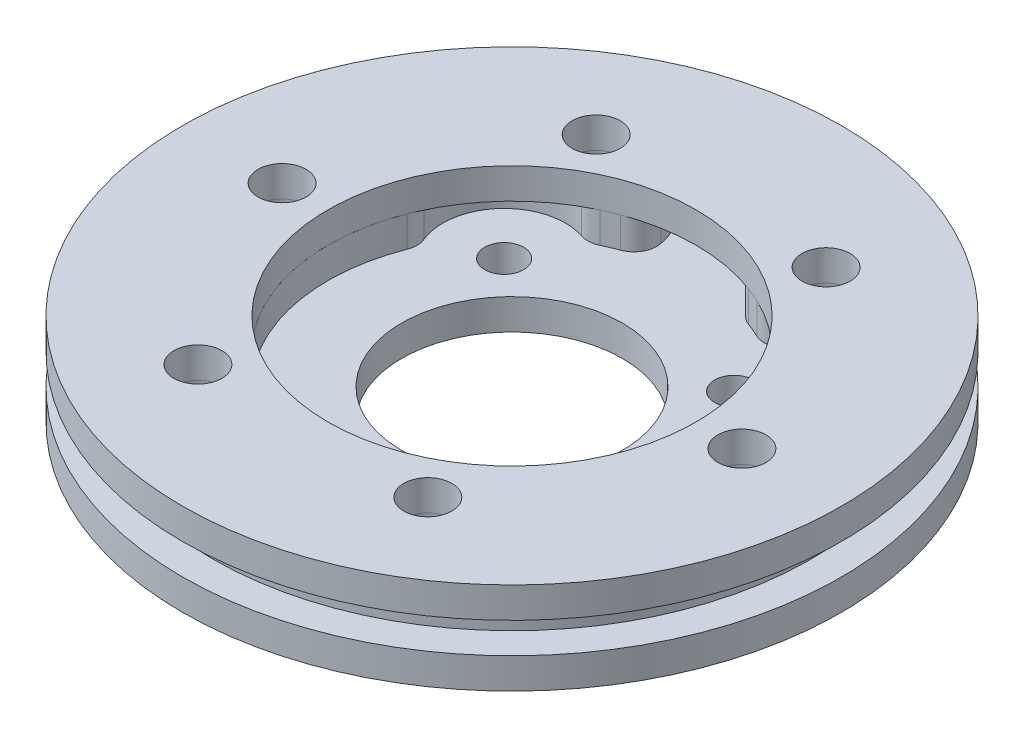
from build123d import *

# Parameters (mm, degrees)
SKETCH1_R           = 2.4892
BOSS_EXTRUDE1_DEPTH = 3.175
SKETCH2_R           = 34.13125
SKETCH2_R_2         = 2.4892
SKETCH2_R_3         = 11.43
SKETCH2_R_4         = 2.0193
BOSS_EXTRUDE2_DEPTH = 3.175
SKETCH3_R           = 6.35
CUT_EXTRUDE1_DEPTH  = 3.175
SKETCH4_R           = 34.13125
SKETCH4_R_2         = 19.05
SKETCH4_R_3         = 2.4892
BOSS_EXTRUDE3_DEPTH = 3.175
FILLET2_R           = 2.38125


with BuildPart() as part:
    # Sketch1 → Boss-Extrude1 (new body)
    with BuildSketch(Plane(origin=(0, 0, 0), x_dir=(1, 0, 0), z_dir=(0, 1, 0))):
        with BuildLine():
            ThreePointArc((-17.376939313, 25.618965517), (-14.497664233, -27.351547412), (30.95625, 0))
            ThreePointArc((30.95625, 0), (27.351547412, 14.497664233), (17.376939313, 25.618965517))
            ThreePointArc((17.376939313, 25.618965517), (8.910502717, 25.899620451), (5.012244188, 18.378789628))
            ThreePointArc((5.012244188, 18.378789628), (15.139117408, 11.563287772), (19.05, 0))
            ThreePointArc((19.05, 0), (-11.563287772, -15.139117408), (-5.012244188, 18.378789628))
            ThreePointArc((-5.012244188, 18.378789628), (-8.910502717, 25.899620451), (-17.376939313, 25.618965517))
        make_face()
        with Locations(Location((-11.90625, -20.622229928, 0), (0, 0, 270))):
            Circle(SKETCH1_R, mode=Mode.SUBTRACT)
        with Locations(Location((-23.8125, 0, 0), (0, 0, 270))):
            Circle(SKETCH1_R, mode=Mode.SUBTRACT)
        with Locations(Location((11.90625, -20.622229928, 0), (0, 0, 270))):
            Circle(SKETCH1_R, mode=Mode.SUBTRACT)
        with Locations(Location((-11.90625, 20.622229928, 0), (0, 0, 270))):
            Circle(SKETCH1_R, mode=Mode.SUBTRACT)
        with Locations(Location((23.8125, 0, 0), (0, 0, 270))):
            Circle(SKETCH1_R, mode=Mode.SUBTRACT)
        with Locations(Location((11.90625, 20.622229928, 0), (0, 0, 270))):
            Circle(SKETCH1_R, mode=Mode.SUBTRACT)
    extrude(amount=-BOSS_EXTRUDE1_DEPTH)

    # Sketch3 → Cut-Extrude1 (cut)
    with BuildSketch(Plane(origin=(0, 0, 0), x_dir=(1, 0, 0), z_dir=(0, 1, 0))):
        with Locations((-11.90625, 11.097229928)):
            Circle(SKETCH3_R)
        with Locations((11.90625, 11.097229928)):
            Circle(SKETCH3_R)
    extrude(amount=-CUT_EXTRUDE1_DEPTH, mode=Mode.SUBTRACT)

    # Fillet2
    fillet2_edges = [part.edges().sort_by_distance(p)[0] for p in [
        (-5.012244188, -1.5875, -18.378789628),
        (5.012244188, -1.5875, -18.378789628),
        (-17.359901154, -1.5875, -7.844509668),
        (-9.044696414, -1.5875, -16.765916819),
        (9.044696414, -1.5875, -16.765916819),
        (17.359901154, -1.5875, -7.844509668),
    ]]
    fillet(fillet2_edges, radius=FILLET2_R)


with BuildPart() as body_2:
    # Sketch2 → Boss-Extrude2 (new body)
    with BuildSketch(Plane(origin=(0, -3.175, 0), x_dir=(-1, 0, 0), z_dir=(0, -1, 0))):
        with Locations(Location((0, 0, 0), (0, 0, 90))):
            Circle(SKETCH2_R)
        with Locations(Location((-11.90625, 20.622229928, 0), (0, 0, 90))):
            Circle(SKETCH2_R_2, mode=Mode.SUBTRACT)
        with Locations(Location((-23.8125, 0, 0), (0, 0, 90))):
            Circle(SKETCH2_R_2, mode=Mode.SUBTRACT)
        with Locations(Location((-11.90625, -20.622229928, 0), (0, 0, 90))):
            Circle(SKETCH2_R_2, mode=Mode.SUBTRACT)
        with Locations(Location((11.90625, -20.622229928, 0), (0, 0, 90))):
            Circle(SKETCH2_R_2, mode=Mode.SUBTRACT)
        with Locations(Location((11.90625, 20.622229928, 0), (0, 0, 90))):
            Circle(SKETCH2_R_2, mode=Mode.SUBTRACT)
        with Locations(Location((23.8125, 0, 0), (0, 0, 90))):
            Circle(SKETCH2_R_2, mode=Mode.SUBTRACT)
        with Locations(Location((0, 0, 0), (0, 0, 90))):
            Circle(SKETCH2_R_3, mode=Mode.SUBTRACT)
        with Locations(Location((11.90625, 11.097229928, 0), (0, 0, 90))):
            Circle(SKETCH2_R_4, mode=Mode.SUBTRACT)
        with Locations(Location((-11.90625, 11.097229928, 0), (0, 0, 90))):
            Circle(SKETCH2_R_4, mode=Mode.SUBTRACT)
    extrude(amount=BOSS_EXTRUDE2_DEPTH)


with BuildPart() as body_3:
    # Sketch4 → Boss-Extrude3 (new body)
    with BuildSketch(Plane(origin=(0, 0, 0), x_dir=(1, 0, 0), z_dir=(0, 1, 0))):
        with Locations(Location((0, 0, 0), (0, 0, 270))):
            Circle(SKETCH4_R)
        with Locations(Location((0, 0, 0), (0, 0, 270))):
            Circle(SKETCH4_R_2, mode=Mode.SUBTRACT)
        with Locations(Location((11.90625, 20.622229928, 0), (0, 0, 270))):
            Circle(SKETCH4_R_3, mode=Mode.SUBTRACT)
        with Locations(Location((23.8125, 0, 0), (0, 0, 270))):
            Circle(SKETCH4_R_3, mode=Mode.SUBTRACT)
        with Locations(Location((11.90625, -20.622229928, 0), (0, 0, 270))):
            Circle(SKETCH4_R_3, mode=Mode.SUBTRACT)
        with Locations(Location((-11.90625, -20.622229928, 0), (0, 0, 270))):
            Circle(SKETCH4_R_3, mode=Mode.SUBTRACT)
        with Locations(Location((-23.8125, 0, 0), (0, 0, 270))):
            Circle(SKETCH4_R_3, mode=Mode.SUBTRACT)
        with Locations(Location((-11.90625, 20.622229928, 0), (0, 0, 270))):
            Circle(SKETCH4_R_3, mode=Mode.SUBTRACT)
    extrude(amount=BOSS_EXTRUDE3_DEPTH)


solid = Compound([part.part, body_2.part, body_3.part])
